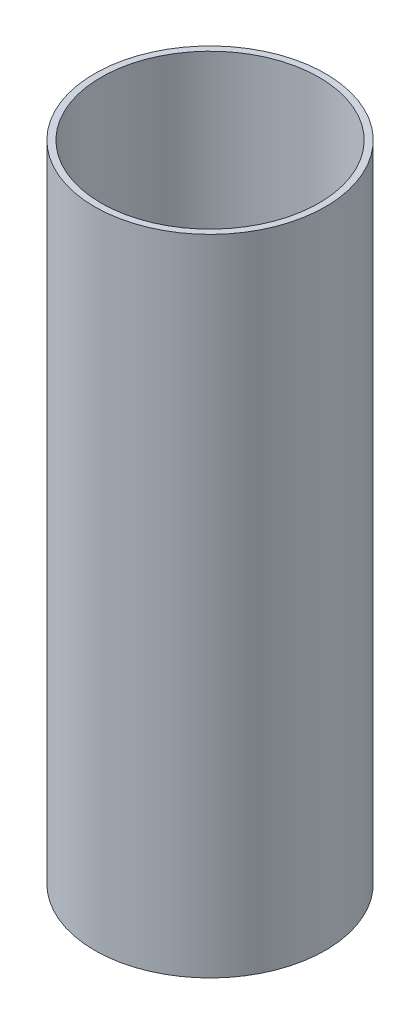
from build123d import *

# Parameters (mm, degrees)
SKETCH1_R           = 28.575
SKETCH1_R_2         = 26.9875
BOSS_EXTRUDE1_DEPTH = 159.4485


with BuildPart() as part:
    # Sketch1 → Boss-Extrude1 (new body)
    with BuildSketch(Plane(origin=(0, 0, 0), x_dir=(1, 0, 0), z_dir=(0, 1, 0))):
        with Locations(Location((0, 0, 0), (0, 0, 270))):
            Circle(SKETCH1_R)
        with Locations(Location((0, 0, 0), (0, 0, 270))):
            Circle(SKETCH1_R_2, mode=Mode.SUBTRACT)
    extrude(amount=BOSS_EXTRUDE1_DEPTH)


solid = part.part
